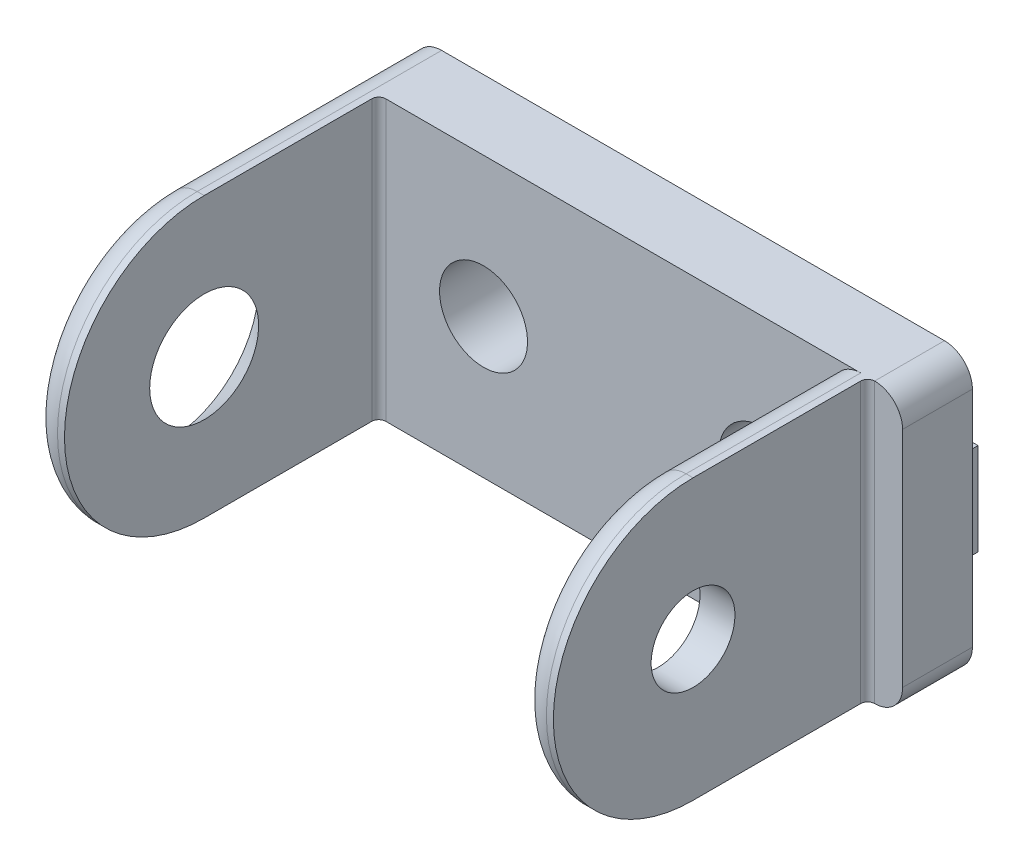
from build123d import *

# Parameters (mm, degrees)
SKETCH_1_W          = 40
SKETCH_1_H          = 20
EXTRUDE_1_DEPTH     = 5
SKETCH_2_W          = 2.5
SKETCH_2_H          = 20
EXTRUDE_2_DEPTH     = 27.5
SKETCH_3_W          = 6.6
SKETCH_3_H          = 3.25
CUT_EXTRUDE_1_DEPTH = 3
SKETCH_3_3_R        = 3.15
CUT_EXTRUDE_2_DEPTH = 53.5
SKETCH_3_4_W        = 3.25
SKETCH_3_4_H        = 6.6
EXTRUDE_3_DEPTH     = 1.4
EXTRUDE_3_2_DEPTH   = 1.4
SKETCH_4_W          = 2.5
SKETCH_4_H          = 20
EXTRUDE_4_DEPTH     = 22.5
CUT_EXTRUDE_3_DEPTH = 53.5
SKETCH_8_W          = 3
SKETCH_8_H          = 2.501
FILLET_2_R          = 2
FILLET_3_R          = 2
FILLET_4_R          = 0.5


with BuildPart() as part:
    # 草图1 → 凸台-拉伸1 (new body)
    with BuildSketch(Plane.XY):
        with Locations((20, -10)):
            Rectangle(SKETCH_1_W, SKETCH_1_H)
    extrude(amount=EXTRUDE_1_DEPTH)

    # 草图2 → 凸台-拉伸2 (add)
    with BuildSketch(Plane.XY):
        with Locations((1.25, -10)):
            Rectangle(SKETCH_2_W, SKETCH_2_H)
    extrude(amount=EXTRUDE_2_DEPTH)

    # 草图3 → 切除-拉伸1 (cut)
    with BuildSketch(Plane(origin=(0, 0, 0), x_dir=(-1, 0, 0), z_dir=(0, 0, -1))):
        with Locations((-30, -2.625)):
            Rectangle(SKETCH_3_W, SKETCH_3_H)
        with Locations((-30, -17.375)):
            Rectangle(SKETCH_3_W, SKETCH_3_H)
        with Locations((-10.02083306, -17.35416694)):
            Rectangle(SKETCH_3_W, SKETCH_3_H)
        with Locations((-9.97916694, -2.60416694)):
            Rectangle(SKETCH_3_W, SKETCH_3_H)
    extrude(amount=-CUT_EXTRUDE_1_DEPTH, mode=Mode.SUBTRACT)

    # 草图3<3> → 切除-拉伸2 (cut, through all)
    with BuildSketch(Plane(origin=(0, 0, 0), x_dir=(-1, 0, 0), z_dir=(0, 0, -1))):
        with Locations((-30, -10)):
            Circle(SKETCH_3_3_R)
        with Locations((-10, -10)):
            Circle(SKETCH_3_3_R)
    extrude(amount=-CUT_EXTRUDE_2_DEPTH, mode=Mode.SUBTRACT)

    # 草图4 → 凸台-拉伸4 (add)
    with BuildSketch(Plane.XY.offset(5)):
        with Locations((36.25, -10)):
            Rectangle(SKETCH_4_W, SKETCH_4_H)
    extrude(amount=EXTRUDE_4_DEPTH)

    # 草图5 → 切除-拉伸3 (cut, through all)
    with BuildSketch(Plane.ZY):
        with BuildLine():
            Line((27.5, -20), (27.5, -10))
            ThreePointArc((27.5, -10), (24.571067812, -17.071067812), (17.5, -20))
            Line((17.5, -20), (27.5, -20))
        make_face()
        with BuildLine():
            Line((27.5, 0), (17.5, 0))
            ThreePointArc((17.5, 0), (24.571067812, -2.928932188), (27.5, -10))
            Line((27.5, -10), (27.5, 0))
        make_face()
    extrude(amount=-CUT_EXTRUDE_3_DEPTH, mode=Mode.SUBTRACT)

    # 草图8 → Hole Wizard M6 _1 (revolve, cut)
    with BuildSketch(Plane(origin=(37.5, -10, 17.5), x_dir=(0, 0, -1), z_dir=(0, 1, 0))):
        with Locations((1.5, 1.2505)):
            Rectangle(SKETCH_8_W, SKETCH_8_H)
    revolve(axis=Axis((43.85, -10, 17.5), (-1, 0, 0)), mode=Mode.SUBTRACT)

    # 草图10 → Hole Wizard M6 _1 2 (revolve, cut)
    with BuildSketch(Plane(origin=(0, -10, 17.5), x_dir=(0, 0, 1), z_dir=(0, 1, 0))):
        Polygon((0, 0), (0, 2.501), (3.3, 2.501), (3.3, 3.1), (6.4, 0), align=None)
    revolve(axis=Axis((-6.35, -10, 17.5), (1, 0, 0)), mode=Mode.SUBTRACT)

    # 圆角2
    fillet_2_edges = [part.edges().sort_by_distance(p)[0] for p in [
        (35, 0, 11.25),
        (35, -20, 11.25),
        (0, -20, 8.75),
        (0, 0, 8.75),
        (35, -10, 27.5),
        (0, -10, 27.5),
    ]]
    fillet(fillet_2_edges, radius=FILLET_2_R)

    # 圆角3
    fillet_3_edges = [part.edges().sort_by_distance(p)[0] for p in [
        (40, 0, 2.5),
        (40, -20, 2.5),
    ]]
    fillet(fillet_3_edges, radius=FILLET_3_R)

    # 圆角4
    fillet_4_edges = [part.edges().sort_by_distance(p)[0] for p in [
        (37.5, -10, 5),
        (2.5, -10, 5),
    ]]
    fillet(fillet_4_edges, radius=FILLET_4_R)


with BuildPart() as body_2:
    # 草图3<4> → 凸台-拉伸3 (new body)
    with BuildSketch(Plane(origin=(0, 0, 0), x_dir=(-1, 0, 0), z_dir=(0, 0, -1))):
        with Locations((-2.625, -10)):
            Rectangle(SKETCH_3_4_W, SKETCH_3_4_H)
    extrude(amount=EXTRUDE_3_DEPTH)


with BuildPart() as body_3:
    # 草图3<4> → Extrude 3 2 (new body)
    with BuildSketch(Plane(origin=(0, 0, 0), x_dir=(-1, 0, 0), z_dir=(0, 0, -1))):
        with Locations((-37.375, -10)):
            Rectangle(SKETCH_3_4_W, SKETCH_3_4_H)
    extrude(amount=EXTRUDE_3_2_DEPTH)


solid = Compound([part.part, body_2.part, body_3.part])
